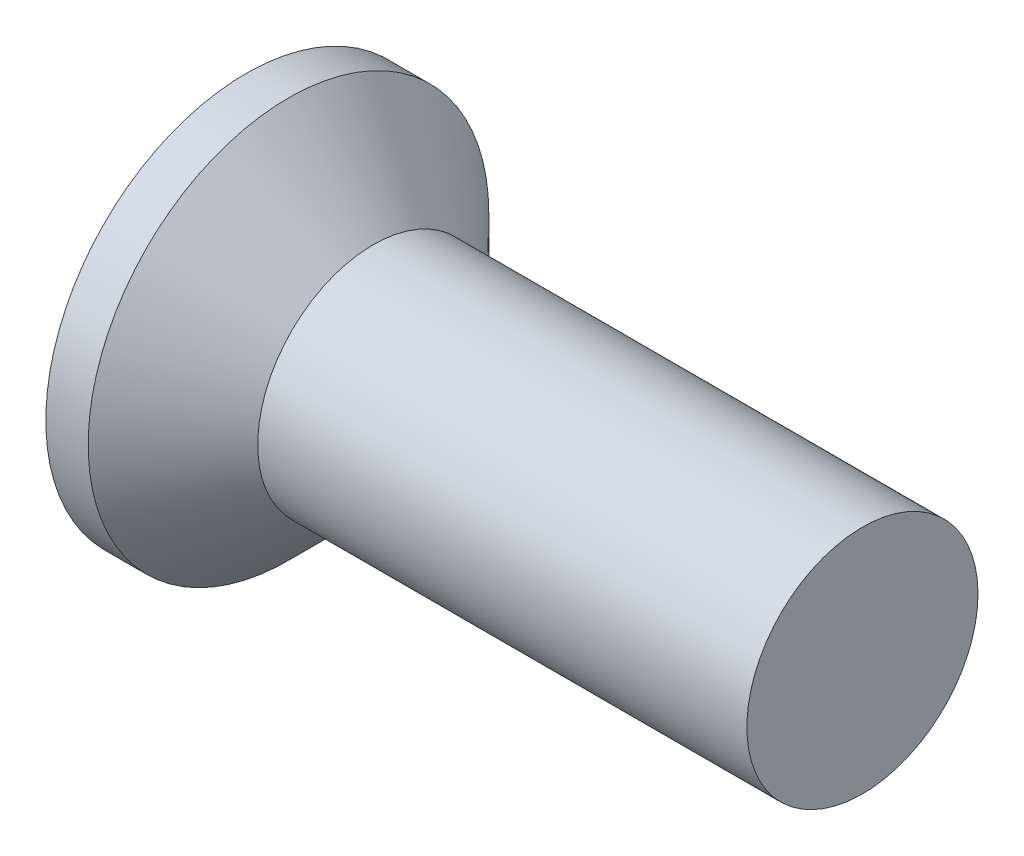
from build123d import *

# Parameters (mm, degrees)
CROSSRECESS_DEPTH = 0.825
DRAFT9_ANGLE      = 30
FILLET5_R         = 0.3


with BuildPart() as part:
    # Sketch1 → Base (revolve)
    with BuildSketch(Plane.XY, mode=Mode.PRIVATE) as base_sk:
        Polygon((8, 1.5), (2.65, 1.5), (1.65, 1.5), (0.55, 2.6), (0, 2.6), (0, 0), (8, 0), align=None)
    revolve(base_sk.sketch.rotate(Axis((4.515812911, 0, 0), (-1, 0, 0)), 90), axis=Axis((4.515812911, 0, 0), (-1, 0, 0)))

    # Sketch6 → CrossRecess (cut)
    with BuildSketch(Plane(origin=(0, 0, 0), x_dir=(0, 0, -1), z_dir=(1, 0, 0))):
        Polygon((0.32, 0.32), (0.32, 1.6), (-0.32, 1.6), (-0.32, 0.32), (-1.6, 0.32), (-1.6, -0.32), (-0.32, -0.32), (-0.32, -1.6), (0.32, -1.6), (0.32, -0.32), (1.6, -0.32), (1.6, 0.32), align=None)
    extrude(amount=CROSSRECESS_DEPTH, mode=Mode.SUBTRACT)

    # Draft9
    draft9_faces = [part.faces().sort_by_distance(p)[0] for p in [
        (0.4125, 1.6, 0),
        (0.4125, 0, 1.6),
        (0.4125, -1.6, 0),
        (0.4125, 0, -1.6),
    ]]
    draft(draft9_faces, Plane(origin=(0, 2.6, 0), x_dir=(0, 0, -1), z_dir=(-1, 0, 0)), DRAFT9_ANGLE)

    # Fillet5
    fillet5_edges = [part.edges().sort_by_distance(p)[0] for p in [
        (0.4125, 0.32, 0.32),
        (0.4125, -0.32, 0.32),
        (0.4125, -0.32, -0.32),
        (0.4125, 0.32, -0.32),
    ]]
    fillet(fillet5_edges, radius=FILLET5_R)


solid = part.part
